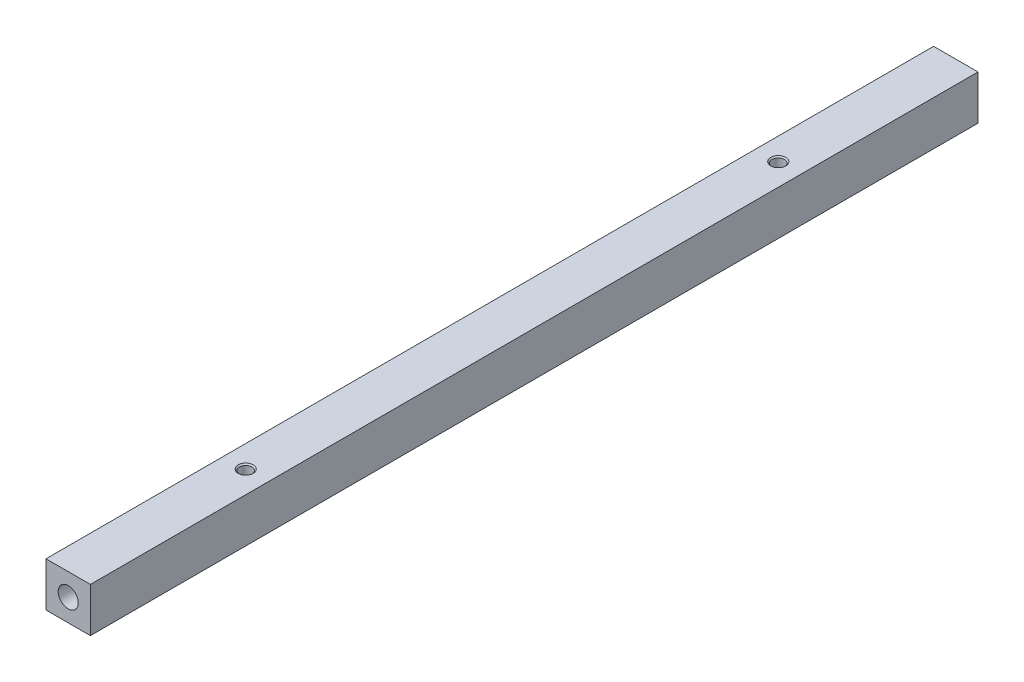
from build123d import *

# Parameters (mm, degrees)
IZIM1_W                     = 15
IZIM1_H                     = 15
Y_KSEKLIK_EKSTR_ZYON1_DEPTH = 150
M5_DI_LI_DELIK1_D           = 4.2
M5_DI_LI_DELIK1_CSINK_D     = 5.05
M5_DI_LI_DELIK1_CSINK_ANGLE = 90


with BuildPart() as part:
    # Çizim1 → Yükseklik-Ekstrüzyon1 (new, symmetric)
    with BuildSketch(Plane.XY):
        Rectangle(IZIM1_W, IZIM1_H)
    extrude(amount=Y_KSEKLIK_EKSTR_ZYON1_DEPTH, both=True)

    # Çizim3 → M8 Dişli Delik1 (revolve, cut)
    with BuildSketch(Plane(origin=(0, 0, 150), x_dir=(0, -1, 0), z_dir=(1, 0, 0))):
        Polygon((0, 0), (0, 24.292926105), (3.4, 22.25), (3.4, 0), align=None)
    m8_di_li_delik1 = revolve(axis=Axis((0, 0, 156.35), (0, 0, -1)), mode=Mode.SUBTRACT)

    # Aynalama1: M8 Dişli Delik1 across plane
    add(m8_di_li_delik1.mirror(Plane.XY), mode=Mode.SUBTRACT)

    # M5 Dişli Delik1 (through all)
    with Locations(Plane(origin=(0, 7.5, 0), x_dir=(1, 0, 0), z_dir=(0, 1, 0))):
        with Locations((0, 90)):
            m5_di_li_delik1 = CounterSinkHole(M5_DI_LI_DELIK1_D / 2, M5_DI_LI_DELIK1_CSINK_D / 2, counter_sink_angle=M5_DI_LI_DELIK1_CSINK_ANGLE)

    # Aynalama2: M5 Dişli Delik1 across plane
    add(m5_di_li_delik1.mirror(Plane.XY), mode=Mode.SUBTRACT)


solid = part.part
